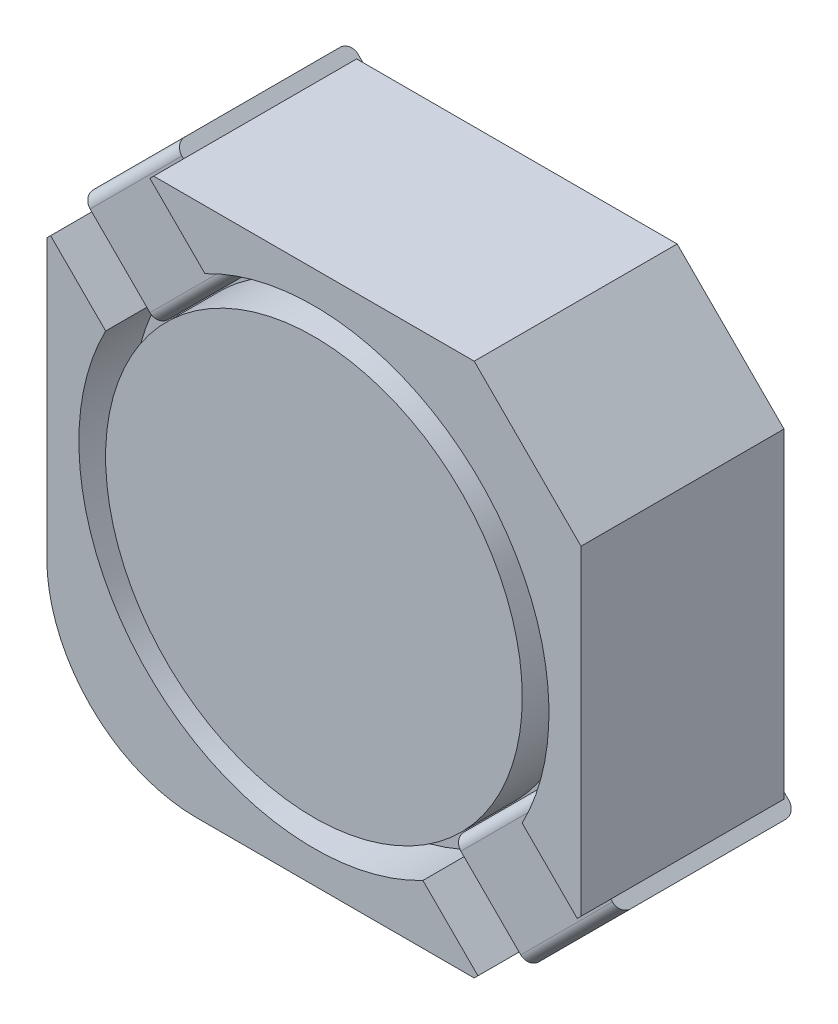
from build123d import *

# Parameters (mm, degrees)
EXTRUDE_START        = 0.1
EXTRUDE_1_DEPTH      = 1.9
SKETCH_6_R           = 2.2
CUT_EXTRUDE_5_DEPTH  = 0.3
SKETCH_8_R           = 1.95
EXTRUDE_9_DEPTH      = 0.25
CUT_EXTRUDE_START    = 1.5
SKETCH_6_3_R         = 2.2
CUT_EXTRUDE_12_DEPTH = 0.6
CUT_EXTRUDE_START_2  = 0.05
SKETCH_12_W          = 0.65
SKETCH_12_H          = 0.899236211
CUT_EXTRUDE_15_DEPTH = 1.314213562
EXTRUDE_START_2      = 1.3
SKETCH_8_3_R         = 1.95
EXTRUDE_16_DEPTH     = 0.7
EXTRUDE_17_DEPTH     = 1.214213562


with BuildPart() as part:
    # Эскиз2 → Вытянуть1 (new body)
    with BuildSketch(Plane.XY.offset(EXTRUDE_START)):
        with BuildLine():
            Line((-1.5, 2.5), (1.5, 2.5))
            Line((1.5, 2.5), (2.5, 1.5))
            Line((2.5, 1.5), (2.5, -1.5))
            Line((2.5, -1.5), (1.5, -2.5))
            Line((1.5, -2.5), (-1.1, -2.5))
            ThreePointArc((-1.1, -2.5), (-2.089949494, -2.089949494), (-2.5, -1.1))
            Line((-2.5, -1.1), (-2.5, 1.5))
            Line((-2.5, 1.5), (-1.5, 2.5))
        make_face()
    extrude(amount=EXTRUDE_1_DEPTH)

    # Эскиз6 → Вытянуть5 (cut)
    with BuildSketch(Plane.XY):
        Circle(SKETCH_6_R)
    extrude(amount=CUT_EXTRUDE_5_DEPTH, mode=Mode.SUBTRACT)

    # Эскиз8 → Вытянуть9 (add)
    with BuildSketch(Plane.XY.offset(EXTRUDE_START)):
        Circle(SKETCH_8_R)
    extrude(amount=EXTRUDE_9_DEPTH)

    # Эскиз6<3> → Вытянуть12 (cut)
    with BuildSketch(Plane.XY.offset(CUT_EXTRUDE_START)):
        Circle(SKETCH_6_3_R)
    extrude(amount=CUT_EXTRUDE_12_DEPTH, mode=Mode.SUBTRACT)

    # Эскиз12 → Вытянуть15 (cut)
    with BuildSketch(Plane(origin=(-0.5, -0.5, 0), x_dir=(0, 0, -1), z_dir=(0.7071067811865499, 0.7071067811865452, 0)).offset(CUT_EXTRUDE_START_2)):
        with Locations((-1.725, 2.449618105)):
            Rectangle(SKETCH_12_W, SKETCH_12_H)
        with Locations((-1.725, -2.449618105)):
            Rectangle(SKETCH_12_W, SKETCH_12_H)
    extrude(amount=CUT_EXTRUDE_15_DEPTH, mode=Mode.SUBTRACT)

    # Эскиз8<3> → Вытянуть16 (add)
    with BuildSketch(Plane.XY.offset(EXTRUDE_START_2)):
        Circle(SKETCH_8_3_R)
    extrude(amount=EXTRUDE_16_DEPTH)

    # Эскиз10 → Вытянуть17 (add)
    with BuildSketch(Plane(origin=(-0.5, -0.5, 0), x_dir=(0, 0, -1), z_dir=(0.7071067811865499, 0.7071067811865452, 0)).offset(EXTRUDE_START)):
        with BuildLine():
            Line((0, 2.058150417), (0, 2.85))
            ThreePointArc((0, 2.85), (-0.029289322, 2.920710678), (-0.1, 2.95))
            Line((-0.1, 2.95), (-1.55, 2.95))
            ThreePointArc((-1.55, 2.95), (-1.620710678, 2.920710678), (-1.65, 2.85))
            Line((-1.65, 2.85), (-1.65, 2.058150417))
            ThreePointArc((-1.65, 2.058150417), (-1.620710678, 1.987439739), (-1.55, 1.958150417))
            Line((-1.55, 1.958150417), (-0.1, 1.958150417))
            ThreePointArc((-0.1, 1.958150417), (-0.029289322, 1.987439739), (0, 2.058150417))
        make_face()
        with BuildLine():
            Line((-1.55, -1.958150417), (-0.1, -1.958150417))
            ThreePointArc((-0.1, -1.958150417), (-0.029289322, -1.987439739), (0, -2.058150417))
            Line((0, -2.058150417), (0, -2.85))
            ThreePointArc((0, -2.85), (-0.029289322, -2.920710678), (-0.1, -2.95))
            Line((-0.1, -2.95), (-1.55, -2.95))
            ThreePointArc((-1.55, -2.95), (-1.620710678, -2.920710678), (-1.65, -2.85))
            Line((-1.65, -2.85), (-1.65, -2.058150417))
            ThreePointArc((-1.65, -2.058150417), (-1.620710678, -1.987439739), (-1.55, -1.958150417))
        make_face()
    extrude(amount=EXTRUDE_17_DEPTH)


solid = part.part
